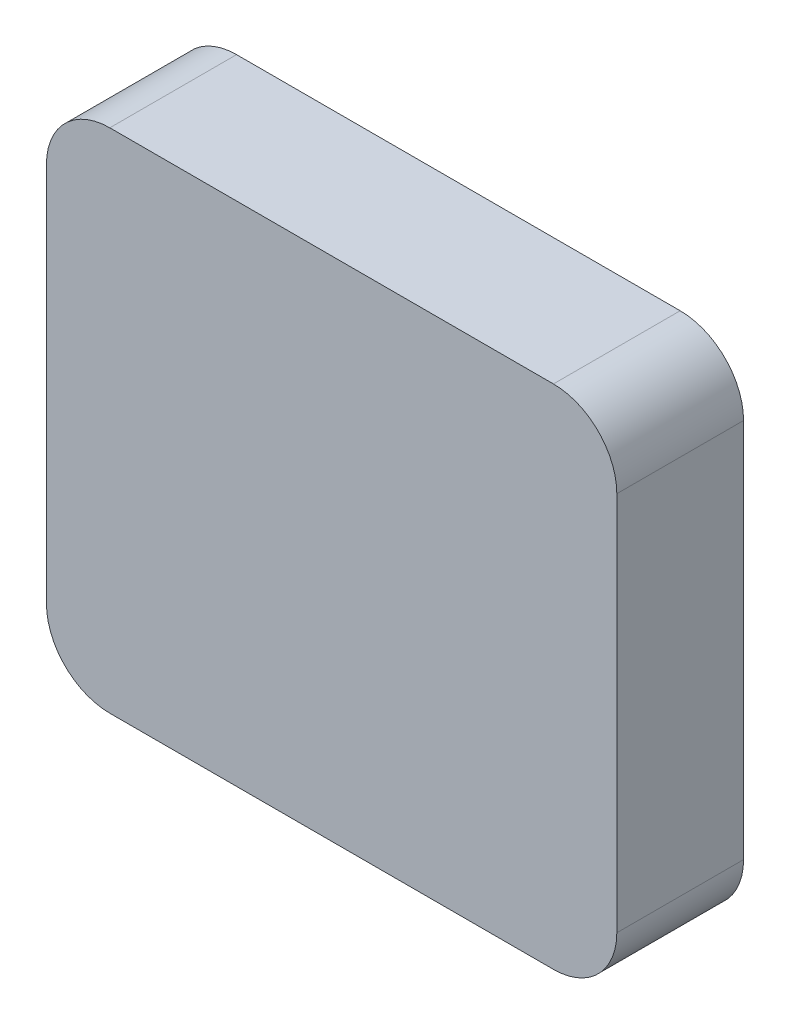
from build123d import *

# Parameters (mm, degrees)
EXTRUDE_1_DEPTH     = 25.4
SKETCH_2_W          = 41.402
SKETCH_2_H          = 41.402
EXTRUDE_2_DEPTH     = 25.4
SKETCH_3_R          = 7.112
CUT_EXTRUDE_1_DEPTH = 25.4


with BuildPart() as part:
    # 草图1 → 凸台-拉伸1 (new body)
    with BuildSketch(Plane.XY):
        with BuildLine():
            Line((12.7, 0), (101.6, 0))
            ThreePointArc((101.6, 0), (110.580256121, 3.719743879), (114.3, 12.7))
            Line((114.3, 12.7), (114.3, 88.9))
            ThreePointArc((114.3, 88.9), (110.580256121, 97.880256121), (101.6, 101.6))
            Line((101.6, 101.6), (12.7, 101.6))
            ThreePointArc((12.7, 101.6), (3.719743879, 97.880256121), (0, 88.9))
            Line((0, 88.9), (0, 12.7))
            ThreePointArc((0, 12.7), (3.719743879, 3.719743879), (12.7, 0))
        make_face()
    extrude(amount=EXTRUDE_1_DEPTH)

    # 草图2 → 凸台-拉伸2 (add)
    with BuildSketch(Plane(origin=(0, 0, 0), x_dir=(-1, 0, 0), z_dir=(0, 0, -1))):
        with Locations((-57.15, 50.8)):
            Rectangle(SKETCH_2_W, SKETCH_2_H)
    extrude(amount=EXTRUDE_2_DEPTH)

    # 草图3 → 切除-拉伸1 (cut)
    with BuildSketch(Plane(origin=(0, 0, -25.4), x_dir=(-1, 0, 0), z_dir=(0, 0, -1))):
        with Locations((-57.15, 50.8)):
            Circle(SKETCH_3_R)
    extrude(amount=-CUT_EXTRUDE_1_DEPTH, mode=Mode.SUBTRACT)


solid = part.part
